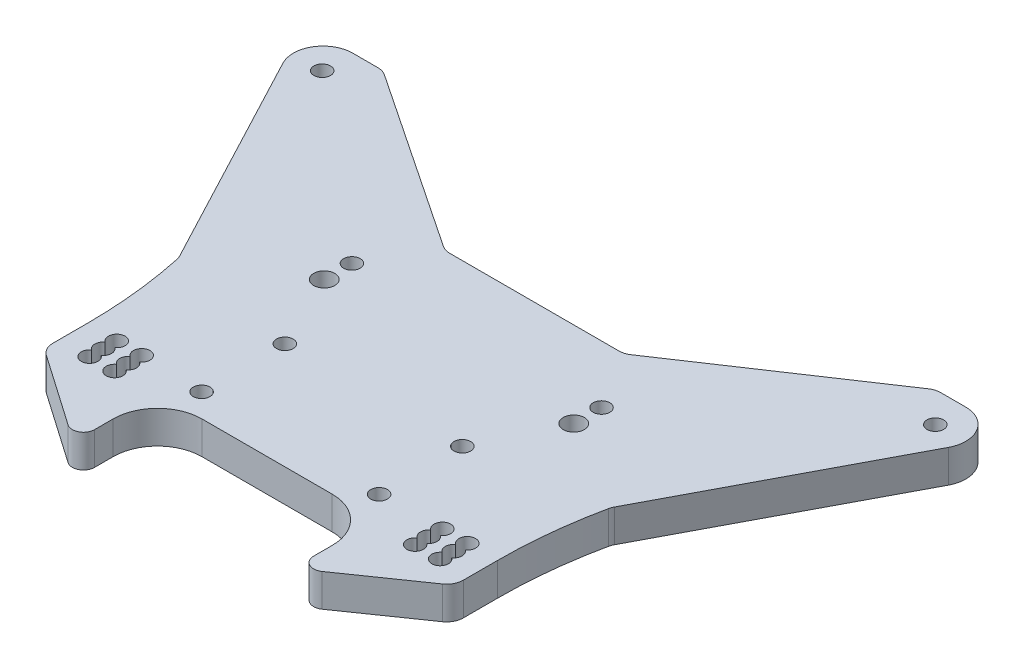
from build123d import *

# Parameters (mm, degrees)
RESSALTO_EXTRUS_O1_DEPTH = 5.9
FILETE1_R                = 8
FILETE2_R                = 3
ESBO_O2_R                = 1.5
CORTE_EXTRUS_O2_DEPTH    = 2
ESBO_O4_R                = 1.5
ESBO_O4_R_2              = 1.9
CORTE_EXTRUS_O3_DEPTH    = 78.327505241


with BuildPart() as part:
    # Esboço1 → Ressalto-extrusão1 (new body)
    with BuildSketch(Plane(origin=(0, 0, 0), x_dir=(1, 0, 0), z_dir=(0, 1, 0))):
        with BuildLine():
            Line((19.75, -23.063762314), (-19.75, -23.063762314))
            Line((-19.75, -23.063762314), (-19.75, -34.413762314))
            ThreePointArc((-19.75, -34.413762314), (-20.823151937, -36.186035619), (-22.890952667, -36.056390395))
            Line((-22.890952667, -36.056390395), (-37, -26.256390395))
            Line((-37, -26.256390395), (-37, -18.556390395))
            ThreePointArc((-37, -18.556390395), (-37.501443682, -9.224461006), (-39, 0))
            Line((-39, 0), (-60, 39.799497484))
            ThreePointArc((-60, 39.799497484), (-59.849748252, 45.058892271), (-55.268281966, 47.646164151))
            Line((-55.268281966, 47.646164151), (-49.818281966, 47.646164151))
            Line((-49.818281966, 47.646164151), (-16.15, 25.136237686))
            Line((-16.15, 25.136237686), (16.15, 25.136237686))
            Line((16.15, 25.136237686), (49.818281966, 47.646164151))
            Line((49.818281966, 47.646164151), (55.268281966, 47.646164151))
            ThreePointArc((55.268281966, 47.646164151), (59.849748252, 45.058892271), (60, 39.799497484))
            Line((60, 39.799497484), (39, 0))
            ThreePointArc((39, 0), (37.501443682, -9.224461006), (37, -18.556390395))
            Line((37, -18.556390395), (37, -26.256390395))
            Line((37, -26.256390395), (22.890952667, -36.056390395))
            ThreePointArc((22.890952667, -36.056390395), (20.823151937, -36.186035619), (19.75, -34.413762314))
            Line((19.75, -34.413762314), (19.75, -23.063762314))
        make_face()
    extrude(amount=RESSALTO_EXTRUS_O1_DEPTH)

    # Filete1
    filete1_edges = [part.edges().sort_by_distance(p)[0] for p in [
        (19.75, 2.95, 23.063762314),
        (-19.75, 2.95, 23.063762314),
    ]]
    fillet(filete1_edges, radius=FILETE1_R)

    # Filete2
    filete2_edges = [part.edges().sort_by_distance(p)[0] for p in [
        (-37, 2.95, 26.256390395),
        (-39, 2.95, 0),
        (-49.818281966, 2.95, -47.646164151),
        (-16.15, 2.95, -25.136237686),
        (16.15, 2.95, -25.136237686),
        (49.818281966, 2.95, -47.646164151),
        (39, 2.95, 0),
        (37, 2.95, 26.256390395),
    ]]
    fillet(filete2_edges, radius=FILETE2_R)

    # Esboço2 → Corte-extrusão2 (cut)
    # profile 1 of 2: a face of its own
    with BuildSketch(Plane.XZ):
        with BuildLine():
            Line((-52.946039299, -45.974436707), (-34.750912081, -34.487114845))
            ThreePointArc((-34.750912081, -34.487114845), (-33.394882191, -28.486599622), (-39.395397414, -27.130569732))
            Line((-39.395397414, -27.130569732), (-57.590524632, -38.617891595))
            ThreePointArc((-57.590524632, -38.617891595), (-58.946554522, -44.618406817), (-52.946039299, -45.974436707))
        make_face()
        with Locations(Location((-55.268281966, -42.146164151, 0), (0, 0, 270))):
            Circle(ESBO_O2_R, mode=Mode.SUBTRACT)
    # profile 2 of 2: a face of its own
    with BuildSketch(Plane.XZ):
        with BuildLine():
            Line((39.395397414, -27.130569732), (57.590524632, -38.617891595))
            ThreePointArc((57.590524632, -38.617891595), (58.946554522, -44.618406817), (52.946039299, -45.974436707))
            Line((52.946039299, -45.974436707), (34.750912081, -34.487114845))
            ThreePointArc((34.750912081, -34.487114845), (33.394882191, -28.486599622), (39.395397414, -27.130569732))
        make_face()
        with Locations(Location((55.268281966, -42.146164151, 0), (0, 0, 90))):
            Circle(ESBO_O2_R, mode=Mode.SUBTRACT)
    extrude(amount=-CORTE_EXTRUS_O2_DEPTH, mode=Mode.SUBTRACT)

    # Esboço4 → Corte-extrusão3 (cut, through all)
    with BuildSketch(Plane.XZ):
        with Locations(Location((-55.268281966, -42.146164151, 0), (0, 0, 270))):
            Circle(ESBO_O4_R)
        with Locations(Location((55.268281966, -42.146164151, 0), (0, 0, 90))):
            Circle(ESBO_O4_R)
        with Locations(Location((-22.5, -14.736237686, 0), (0, 0, 270))):
            Circle(ESBO_O4_R)
        with Locations(Location((-22.5, -9.736237686, 0), (0, 0, 270))):
            Circle(ESBO_O4_R_2)
        with Locations(Location((-16, 3.863762314, 0), (0, 0, 270))):
            Circle(ESBO_O4_R)
        with Locations(Location((-16, 18.863762314, 0), (0, 0, 270))):
            Circle(ESBO_O4_R)
        with Locations(Location((16, 18.863762314, 0), (0, 0, 90))):
            Circle(ESBO_O4_R)
        with Locations(Location((16, 3.863762314, 0), (0, 0, 90))):
            Circle(ESBO_O4_R)
        with Locations(Location((22.5, -9.736237686, 0), (0, 0, 90))):
            Circle(ESBO_O4_R_2)
        with Locations(Location((22.5, -14.736237686, 0), (0, 0, 90))):
            Circle(ESBO_O4_R)
        with BuildLine():
            ThreePointArc((-32.465664485, 19.788762314), (-31.6, 17.063762314), (-30.734335515, 19.788762314))
            ThreePointArc((-30.734335515, 19.788762314), (-30.1, 21.013762314), (-30.734335515, 22.238762314))
            ThreePointArc((-30.734335515, 22.238762314), (-31.6, 24.963762314), (-32.465664485, 22.238762314))
            ThreePointArc((-32.465664485, 22.238762314), (-33.1, 21.013762314), (-32.465664485, 19.788762314))
        make_face()
        with BuildLine():
            ThreePointArc((-27.965664485, 19.788762314), (-27.1, 17.063762314), (-26.234335515, 19.788762314))
            ThreePointArc((-26.234335515, 19.788762314), (-25.6, 21.013762314), (-26.234335515, 22.238762314))
            ThreePointArc((-26.234335515, 22.238762314), (-27.1, 24.963762314), (-27.965664485, 22.238762314))
            ThreePointArc((-27.965664485, 22.238762314), (-28.6, 21.013762314), (-27.965664485, 19.788762314))
        make_face()
        with BuildLine():
            ThreePointArc((26.234335515, 19.788762314), (25.6, 21.013762314), (26.234335515, 22.238762314))
            ThreePointArc((26.234335515, 22.238762314), (27.1, 24.963762314), (27.965664485, 22.238762314))
            ThreePointArc((27.965664485, 22.238762314), (28.6, 21.013762314), (27.965664485, 19.788762314))
            ThreePointArc((27.965664485, 19.788762314), (27.1, 17.063762314), (26.234335515, 19.788762314))
        make_face()
        with BuildLine():
            ThreePointArc((30.734335515, 19.788762314), (30.1, 21.013762314), (30.734335515, 22.238762314))
            ThreePointArc((30.734335515, 22.238762314), (31.6, 24.963762314), (32.465664485, 22.238762314))
            ThreePointArc((32.465664485, 22.238762314), (33.1, 21.013762314), (32.465664485, 19.788762314))
            ThreePointArc((32.465664485, 19.788762314), (31.6, 17.063762314), (30.734335515, 19.788762314))
        make_face()
    extrude(amount=-CORTE_EXTRUS_O3_DEPTH, mode=Mode.SUBTRACT)


solid = part.part
